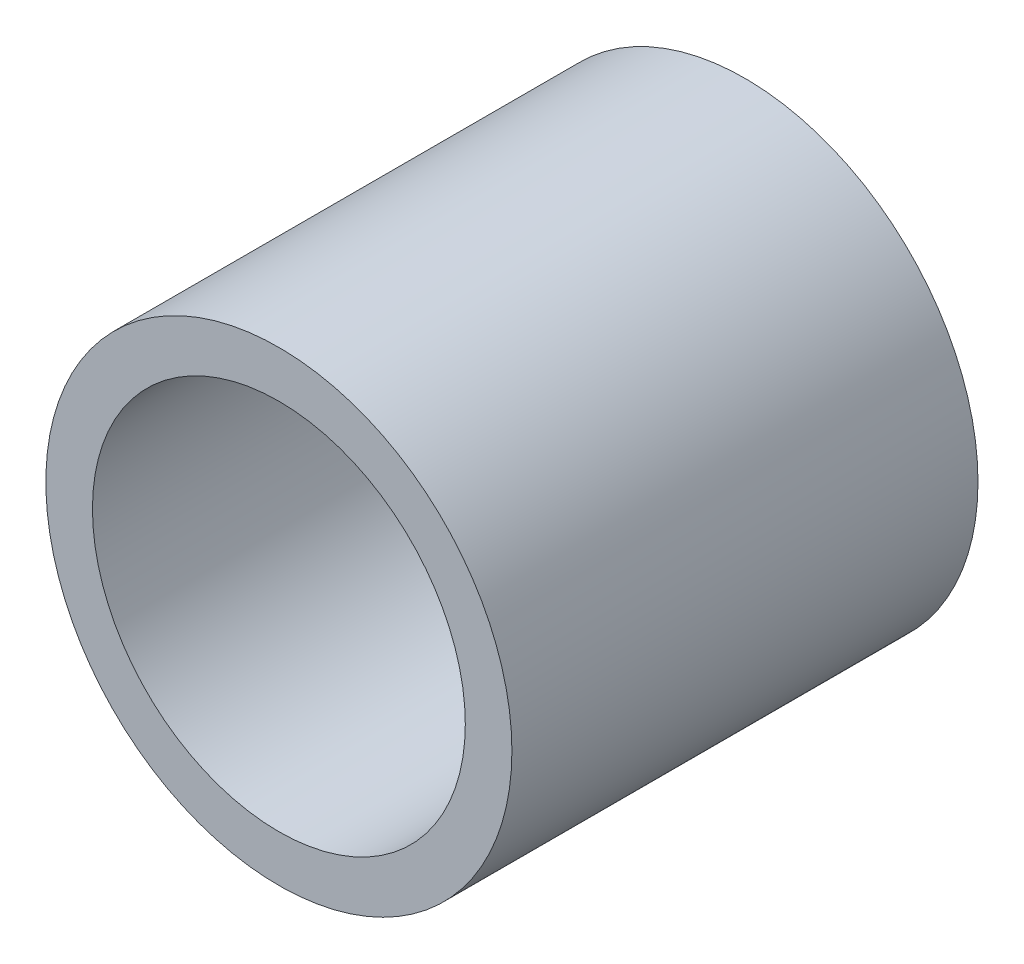
from build123d import *

# Parameters (mm, degrees)
SKIZZE1_R                       = 2.75
SKIZZE1_R_2                     = 2.2
AUFSATZ_LINEAR_AUSTRAGEN1_DEPTH = 5.5


with BuildPart() as part:
    # Skizze1 → Aufsatz-Linear austragen1 (new body)
    with BuildSketch(Plane.XY):
        Circle(SKIZZE1_R)
        Circle(SKIZZE1_R_2, mode=Mode.SUBTRACT)
    extrude(amount=AUFSATZ_LINEAR_AUSTRAGEN1_DEPTH)


solid = part.part
